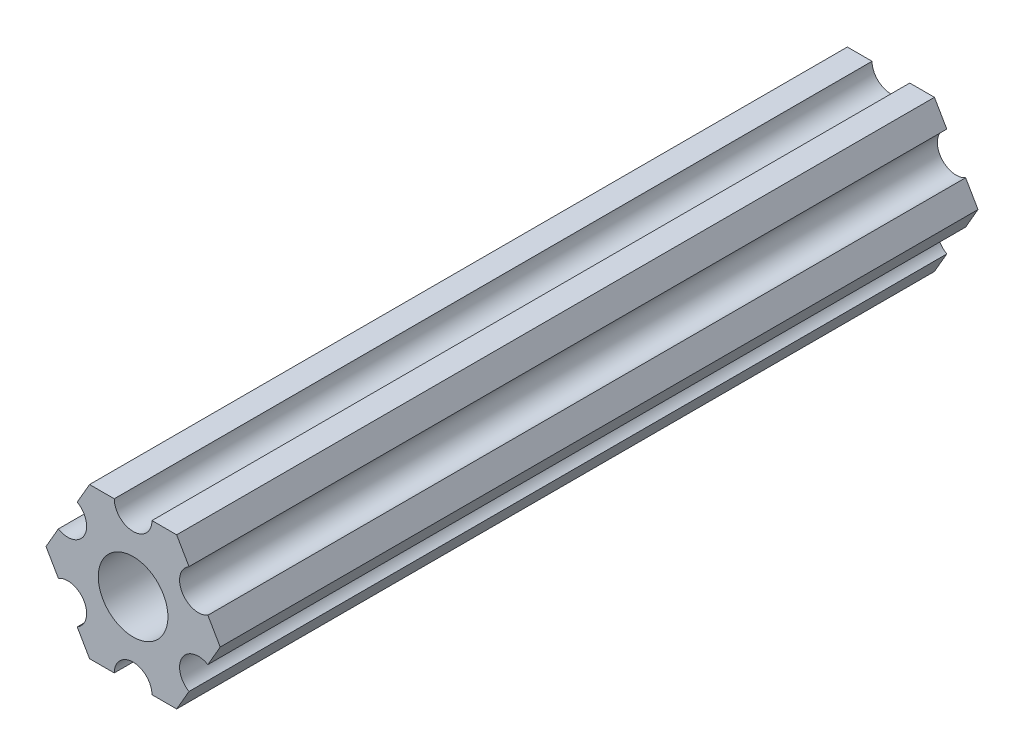
from build123d import *

# Parameters (mm, degrees)
SKETCH1_R           = 2.9337
BOSS_EXTRUDE1_DEPTH = 63.79


with BuildPart() as part:
    # Sketch1 → Boss-Extrude1 (new body)
    with BuildSketch(Plane(origin=(0, 0, 0), x_dir=(-1, 0, 0), z_dir=(0, 0, -1))):
        with BuildLine():
            Line((-4.70551159, -4.549815043), (-3.666174521, -6.349999904))
            Line((-3.666174521, -6.349999904), (-1.587500385, -6.349999904))
            ThreePointArc((-1.587500385, -6.349999904), (-3.85e-07, -4.762499904), (1.587499615, -6.349999904))
            Line((1.587499615, -6.349999904), (3.666173825, -6.349999904))
            Line((3.666173825, -6.349999904), (4.705510942, -4.54981524))
            ThreePointArc((4.705510942, -4.54981524), (4.124445629, -2.381249907), (6.293010962, -1.800184594))
            Line((6.293010962, -1.800184594), (7.332348079, 7e-08))
            Line((7.332348079, 7e-08), (6.293011217, 1.800184685))
            ThreePointArc((6.293011217, 1.800184685), (4.124445939, 2.381250203), (4.705511457, 4.549815481))
            Line((4.705511457, 4.549815481), (3.666174521, 6.350000222))
            Line((3.666174521, 6.350000222), (1.587500385, 6.350000222))
            ThreePointArc((1.587500385, 6.350000222), (3.85e-07, 4.762500222), (-1.587499615, 6.350000222))
            Line((-1.587499615, 6.350000222), (-3.666173825, 6.350000222))
            Line((-3.666173825, 6.350000222), (-4.705511038, 4.549815614))
            ThreePointArc((-4.705511038, 4.549815614), (-4.124445841, 2.38125025), (-6.293011205, 1.800185053))
            Line((-6.293011205, 1.800185053), (-7.332348419, 4.44e-07))
            Line((-7.332348419, 4.44e-07), (-6.293011423, -1.80018429))
            ThreePointArc((-6.293011423, -1.80018429), (-4.12444613, -2.38124975), (-4.70551159, -4.549815043))
        make_face()
        with Locations(Location((0, 0, 0), (0, 0, 180))):
            Circle(SKETCH1_R, mode=Mode.SUBTRACT)
    extrude(amount=-BOSS_EXTRUDE1_DEPTH)


solid = part.part
